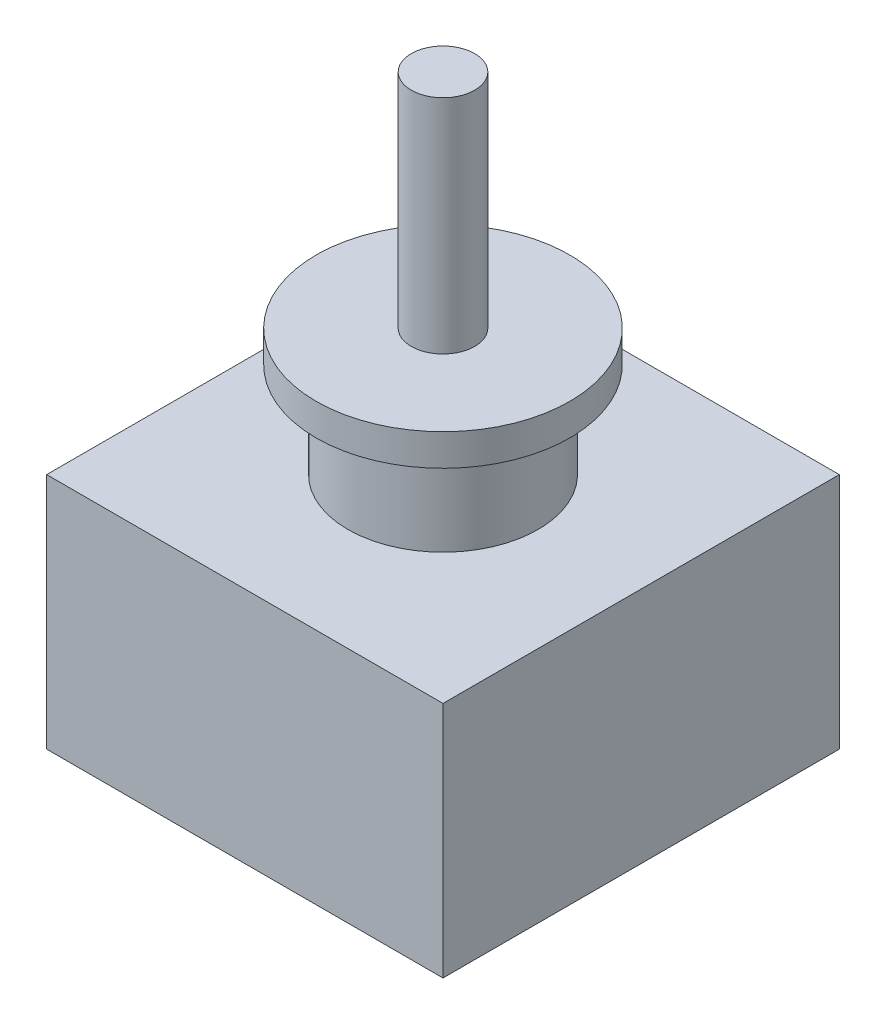
from build123d import *

# Parameters (mm, degrees)
ESQUISSE1_W      = 25
ESQUISSE1_H      = 25
EXTRUSION1_DEPTH = 15
ESQUISSE2_R      = 6
EXTRUSION2_DEPTH = 6
ESQUISSE3_R      = 8
EXTRUSION3_DEPTH = 2
ESQUISSE4_R      = 2
EXTRUSION4_DEPTH = 14


with BuildPart() as part:
    # Esquisse1 → Extrusion1 (new body)
    with BuildSketch(Plane(origin=(0, 0, 0), x_dir=(1, 0, 0), z_dir=(0, 1, 0))):
        Rectangle(ESQUISSE1_W, ESQUISSE1_H)
    extrude(amount=EXTRUSION1_DEPTH)

    # Esquisse2 → Extrusion2 (add)
    with BuildSketch(Plane(origin=(0, 15, 0), x_dir=(-1, 0, 0), z_dir=(0, 1, 0))):
        with Locations(Location((0, 0, 0), (0, 0, 270))):
            Circle(ESQUISSE2_R)
    extrude(amount=EXTRUSION2_DEPTH)

    # Esquisse3 → Extrusion3 (add)
    with BuildSketch(Plane(origin=(0, 21, 0), x_dir=(-1, 0, 0), z_dir=(0, 1, 0))):
        with Locations(Location((0, 0, 0), (0, 0, 90))):
            Circle(ESQUISSE3_R)
    extrude(amount=EXTRUSION3_DEPTH)

    # Esquisse4 → Extrusion4 (add)
    with BuildSketch(Plane(origin=(0, 23, 0), x_dir=(-1, 0, 0), z_dir=(0, 1, 0))):
        with Locations(Location((0, 0, 0), (0, 0, 90))):
            Circle(ESQUISSE4_R)
    extrude(amount=EXTRUSION4_DEPTH)


solid = part.part
